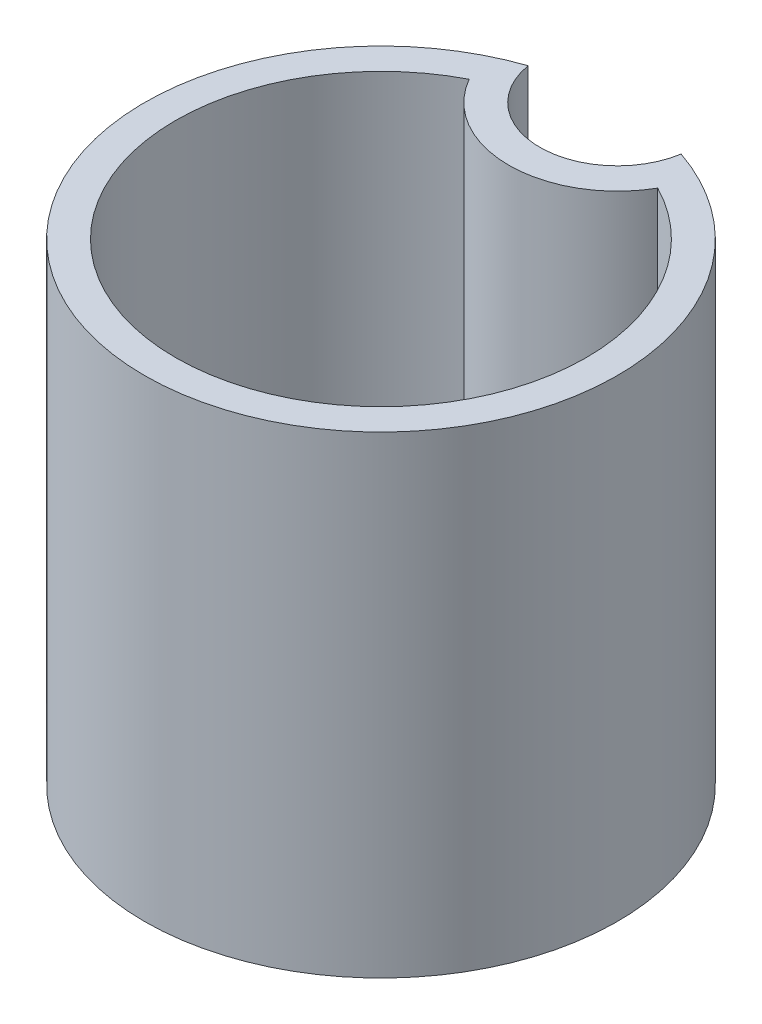
from build123d import *

# Parameters (mm, degrees)
BOSS_EXTRUDE1_DEPTH = 76.2
BOSS_EXTRUDE2_DEPTH = 5


with BuildPart() as part:
    # Sketch1 → Boss-Extrude1 (new body)
    with BuildSketch(Plane(origin=(0, 0, 0), x_dir=(1, 0, 0), z_dir=(0, 1, 0))):
        with BuildLine():
            ThreePointArc((12.330666952, 36.049475066), (0, 25.6), (-12.330666952, 36.049475066))
            ThreePointArc((-12.330666953, 36.049475066), (0, -38.1), (12.330666953, 36.049475066))
        make_face()
        with BuildLine():
            ThreePointArc((-15.189386988, 29.409055118), (0, 20.6), (15.189386988, 29.409055118))
            ThreePointArc((15.189386988, 29.409055118), (0, -33.1), (-15.189386988, 29.409055118))
        make_face(mode=Mode.SUBTRACT)
    extrude(amount=BOSS_EXTRUDE1_DEPTH)

    # Sketch1<3> → Boss-Extrude2 (add)
    with BuildSketch(Plane(origin=(0, 0, 0), x_dir=(1, 0, 0), z_dir=(0, 1, 0))):
        with BuildLine():
            ThreePointArc((33.1, 0), (28.269937295, 17.216870951), (15.189386988, 29.409055118))
            ThreePointArc((15.189386988, 29.409055118), (0, 20.6), (-15.189386988, 29.409055118))
            ThreePointArc((-15.189386988, 29.409055118), (-17.216870951, -28.269937295), (33.1, 0))
        make_face()
    extrude(amount=BOSS_EXTRUDE2_DEPTH)


solid = part.part
